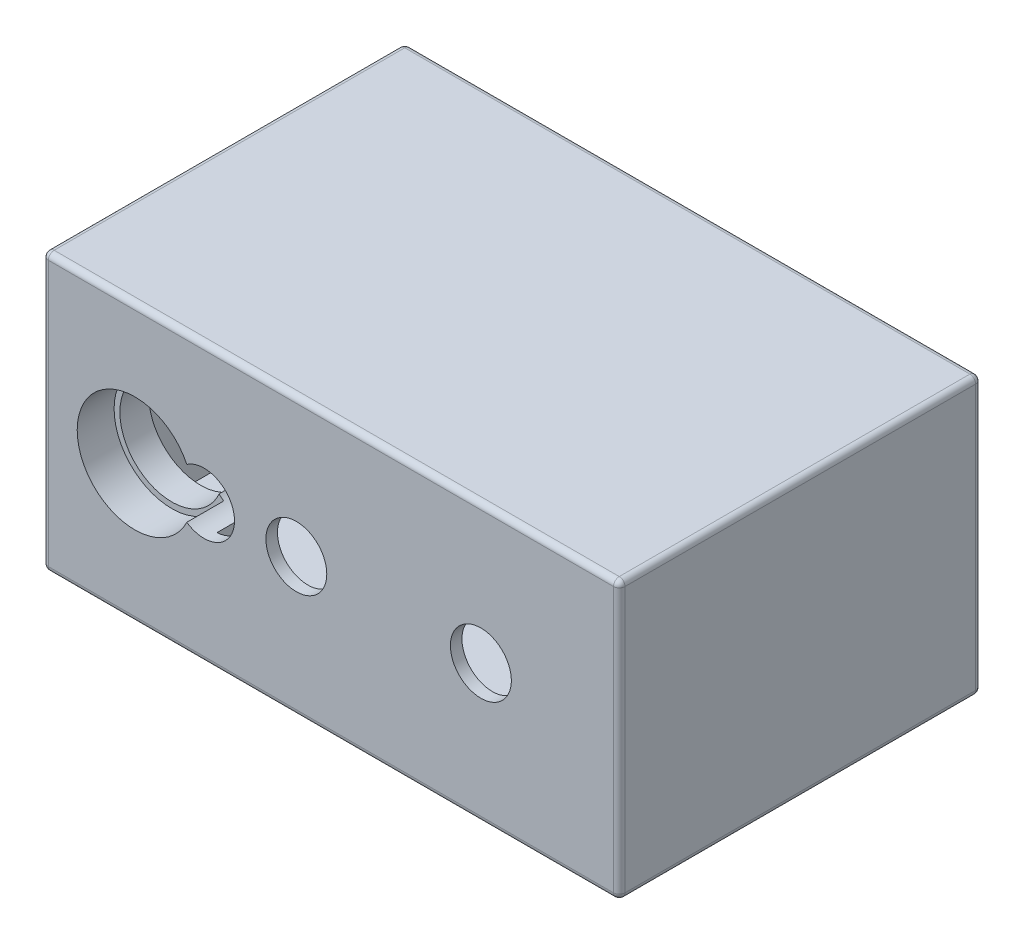
from build123d import *

# Parameters (mm, degrees)
SKETCH1_W           = 158.75
SKETCH1_H           = 76.2
SKETCH1_R           = 8.382
BOSS_EXTRUDE1_DEPTH = 3.175
SKETCH2_W           = 3.175
SKETCH2_H           = 76.2
BOSS_EXTRUDE2_DEPTH = 96.52
SKETCH5_W           = 38.496875
SKETCH5_H           = 14.9225
BOSS_EXTRUDE4_DEPTH = 76.2
CUT_EXTRUDE3_REACH  = 172.801
SKETCH10_R          = 8.382
SKETCH10_3_R        = 8.382
SKETCH10_3_R_2      = 15.875
CUT_EXTRUDE4_DEPTH  = 10.16
CUT_EXTRUDE5_REACH  = 167.077
SKETCH11_R          = 14.2875
SKETCH12_R          = 8.382
CUT_EXTRUDE6_DEPTH  = 171.800835844
BOSS_EXTRUDE5_REACH = 193.291
SKETCH13_W          = 99.695
SKETCH13_H          = 3.175
FILLET1_R           = 1.5875


with BuildPart() as part:
    # Sketch1 → Boss-Extrude1 (new body)
    with BuildSketch(Plane.XY):
        with Locations((53.975, 0)):
            Rectangle(SKETCH1_W, SKETCH1_H)
        Circle(SKETCH1_R, mode=Mode.SUBTRACT)
        with Locations((19.05, 0)):
            Circle(SKETCH1_R, mode=Mode.SUBTRACT)
        with Locations((44.45, 0)):
            Circle(SKETCH1_R, mode=Mode.SUBTRACT)
    extrude(amount=BOSS_EXTRUDE1_DEPTH)

    # Sketch2 → Boss-Extrude2 (add)
    with BuildSketch(Plane.XY.offset(3.175)):
        with Locations((-23.8125, 0)):
            Rectangle(SKETCH2_W, SKETCH2_H)
        with Locations((131.7625, 0)):
            Rectangle(SKETCH2_W, SKETCH2_H)
    extrude(amount=BOSS_EXTRUDE2_DEPTH)

    # Sketch5 → Boss-Extrude4 (add)
    with BuildSketch(Plane(origin=(0, 38.1, 0), x_dir=(1, 0, 0), z_dir=(0, 1, 0))):
        with Locations((-2.9765625, -92.23375)):
            Rectangle(SKETCH5_W, SKETCH5_H)
        Polygon((-22.225, -81.5975), (-22.225, -84.7725), (16.271875, -84.7725), (16.271875, -99.695), (130.175, -99.695), (130.175, -96.52), (19.446875, -96.52), (19.446875, -81.5975), align=None)
    extrude(amount=-BOSS_EXTRUDE4_DEPTH)

    # Sketch10 → Cut-Extrude3 (cut, up to next)
    with BuildSketch(Plane.XY.offset(99.695), mode=Mode.PRIVATE) as cut_extrude3_sk1:
        with Locations((19.05, 0)):
            Circle(SKETCH10_R)
    cut_extrude3_tool1 = extrude(cut_extrude3_sk1.sketch, amount=-CUT_EXTRUDE3_REACH, mode=Mode.PRIVATE) & part.part
    # Sketch10 → Cut-Extrude3 (cut, up to next)
    with BuildSketch(Plane.XY.offset(99.695), mode=Mode.PRIVATE) as cut_extrude3_sk2:
        with Locations((44.45, 0)):
            Circle(SKETCH10_R)
    cut_extrude3_tool2 = extrude(cut_extrude3_sk2.sketch, amount=-CUT_EXTRUDE3_REACH, mode=Mode.PRIVATE) & part.part
    add(cut_extrude3_tool1.solids().sort_by_distance((19.05, 0, 99.695))[0], mode=Mode.SUBTRACT)
    add(cut_extrude3_tool2.solids().sort_by_distance((44.45, 0, 99.695))[0], mode=Mode.SUBTRACT)

    # Sketch10<3> → Cut-Extrude4 (cut)
    with BuildSketch(Plane.XY.offset(99.695)):
        with Locations((19.05, 0)):
            Circle(SKETCH10_3_R)
        Circle(SKETCH10_3_R_2)
    extrude(amount=-CUT_EXTRUDE4_DEPTH, mode=Mode.SUBTRACT)

    # Sketch11 → Cut-Extrude5 (cut, up to next)
    with BuildSketch(Plane.XY.offset(89.535), mode=Mode.PRIVATE) as cut_extrude5_sk1:
        Circle(SKETCH11_R)
    cut_extrude5_tool1 = extrude(cut_extrude5_sk1.sketch, amount=-CUT_EXTRUDE5_REACH, mode=Mode.PRIVATE) & part.part
    add(cut_extrude5_tool1.solids().sort_by_distance((0, 0, 89.535))[0], mode=Mode.SUBTRACT)

    # Sketch12 → Cut-Extrude6 (cut, through all)
    with BuildSketch(Plane(origin=(0, 0, 0), x_dir=(-1, 0, 0), z_dir=(0, 0, -1))):
        with Locations((-95.25, 0)):
            Circle(SKETCH12_R)
    extrude(amount=-CUT_EXTRUDE6_DEPTH, mode=Mode.SUBTRACT)

    # Boss-Extrude5: up to this face of the body (flat: up to its plane)
    boss_extrude5_end = Plane(part.part.faces().sort_by_distance((-25.4, 0, 49.8475))[0])
    # Sketch13 → Boss-Extrude5 (add, up to the picked face)
    with BuildSketch(Plane(origin=(133.35, 0, 0), x_dir=(0, 0, -1), z_dir=(1, 0, 0)), mode=Mode.PRIVATE) as boss_extrude5_sk1:
        with Locations((-49.8475, -36.5125)):
            Rectangle(SKETCH13_W, SKETCH13_H)
    boss_extrude5_tool1 = split(extrude(boss_extrude5_sk1.sketch, amount=-BOSS_EXTRUDE5_REACH, mode=Mode.PRIVATE), bisect_by=boss_extrude5_end, keep=Keep.BOTH, mode=Mode.PRIVATE)
    # Sketch13 → Boss-Extrude5 (add, up to the picked face)
    with BuildSketch(Plane(origin=(133.35, 0, 0), x_dir=(0, 0, -1), z_dir=(1, 0, 0)), mode=Mode.PRIVATE) as boss_extrude5_sk2:
        with Locations((-49.8475, 36.5125)):
            Rectangle(SKETCH13_W, SKETCH13_H)
    boss_extrude5_tool2 = split(extrude(boss_extrude5_sk2.sketch, amount=-BOSS_EXTRUDE5_REACH, mode=Mode.PRIVATE), bisect_by=boss_extrude5_end, keep=Keep.BOTH, mode=Mode.PRIVATE)
    add(boss_extrude5_tool1.solids().sort_by(Axis((133.35, -36.5125, 49.8475), (-1, 0, 0)))[0])
    add(boss_extrude5_tool2.solids().sort_by(Axis((133.35, 36.5125, 49.8475), (-1, 0, 0)))[0])

    # Fillet1
    fillet1_edges = [part.edges().sort_by_distance(p)[0] for p in [
        (-25.4, 0, 99.695),
        (53.975, -38.1, 99.695),
        (53.975, 38.1, 99.695),
        (133.35, 0, 99.695),
        (53.975, 38.1, 0),
        (133.35, 0, 0),
        (53.975, -38.1, 0),
        (-25.4, 0, 0),
        (-25.4, 38.1, 49.8475),
        (133.35, 38.1, 49.8475),
        (133.35, -38.1, 49.8475),
        (-25.4, -38.1, 49.8475),
    ]]
    fillet(fillet1_edges, radius=FILLET1_R)


solid = part.part
